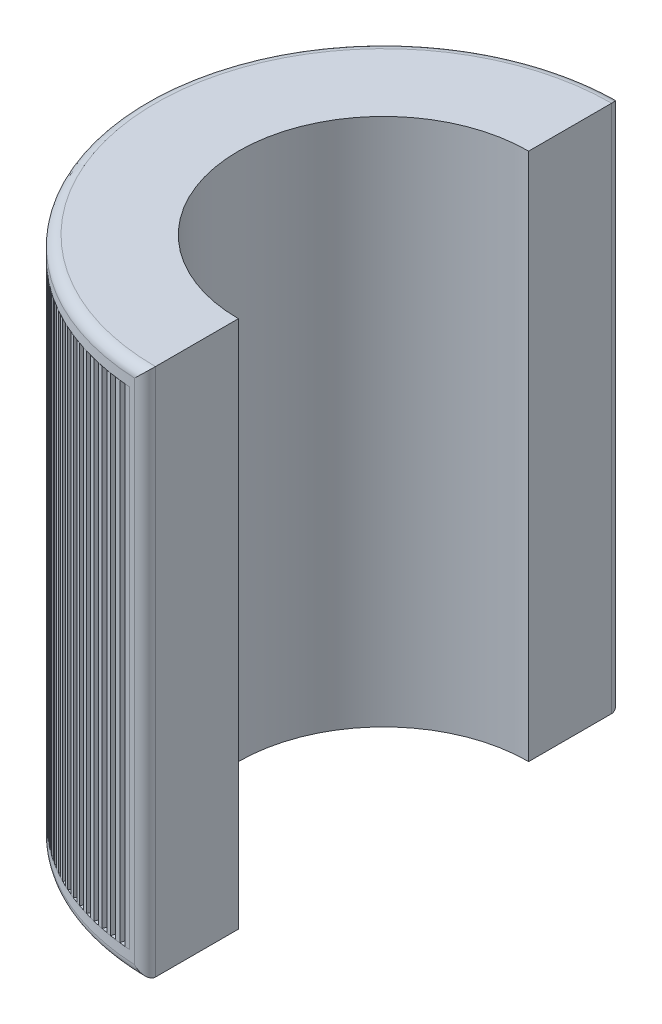
from build123d import *

# Parameters (mm, degrees)
Y_KSEKLIK_EKSTR_ZYON1_DEPTH = 255
BO_ALTMA1_T                 = -10
Y_KSEKLIK_EKSTR_ZYON2_DEPTH = 235
DAIRESEL_KAPLAMA2_COUNT     = 67
DAIRESEL_KAPLAMA2_ANGLE     = 170
RADYUS1_R                   = 5


with BuildPart() as part:
    # Çizim2 → Yükseklik-Ekstrüzyon1 (new body)
    with BuildSketch(Plane(origin=(0, 0, 0), x_dir=(1, 0, 0), z_dir=(0, 1, 0))):
        with BuildLine():
            Line((0, 115), (0, 70))
            ThreePointArc((0, 70), (-70, 0), (0, -70))
            Line((0, -70), (0, -115))
            ThreePointArc((0, -115), (-115, 0), (0, 115))
        make_face()
    extrude(amount=Y_KSEKLIK_EKSTR_ZYON1_DEPTH)

    # İç Boşaltma1
    bo_altma1_openings = [part.faces().sort_by_distance(p)[0] for p in [
        (-115, 127.5, 0),
    ]]
    offset(amount=BO_ALTMA1_T, openings=bo_altma1_openings, kind=Kind.INTERSECTION)

    # Radyus1
    radyus1_edges = [part.edges().sort_by_distance(p)[0] for p in [
        (-115, 255, 0),
        (-115, 0, 0),
        (0, 127.5, 115),
        (0, 127.5, -115),
    ]]
    fillet(radyus1_edges, radius=RADYUS1_R)


with BuildPart() as body_2:
    # Çizim3 → Yükseklik-Ekstrüzyon2 (new body)
    with BuildSketch(Plane(origin=(0, 10, 0), x_dir=(1, 0, 0), z_dir=(0, 1, 0))):
        with BuildLine():
            Line((-10, 114.564392374), (-10, 110.533750576))
            Line((-10, 110.533750576), (-10, 79.372539332))
            ThreePointArc((-10, 79.372539332), (-11.121674524, 79.223155427), (-12.241123897, 79.057921082))
            Line((-12.241123897, 79.057921082), (-12.241123897, 114.346643526))
            ThreePointArc((-12.241123897, 114.346643526), (-11.121094896, 114.461003177), (-10, 114.564392374))
        make_face()
    extrude(amount=Y_KSEKLIK_EKSTR_ZYON2_DEPTH)

    # Dairesel Kaplama2: body 2 ×67 about axis
    dairesel_kaplama2_axis = Axis((0, 0, 0), (0, 1, 0))


with BuildPart() as body_2_1:
    add(body_2.part)
    for i in range(1, DAIRESEL_KAPLAMA2_COUNT):
        add(body_2.part.rotate(dairesel_kaplama2_axis, i * DAIRESEL_KAPLAMA2_ANGLE / (DAIRESEL_KAPLAMA2_COUNT - 1)))


solid = Compound([part.part, body_2_1.part])
